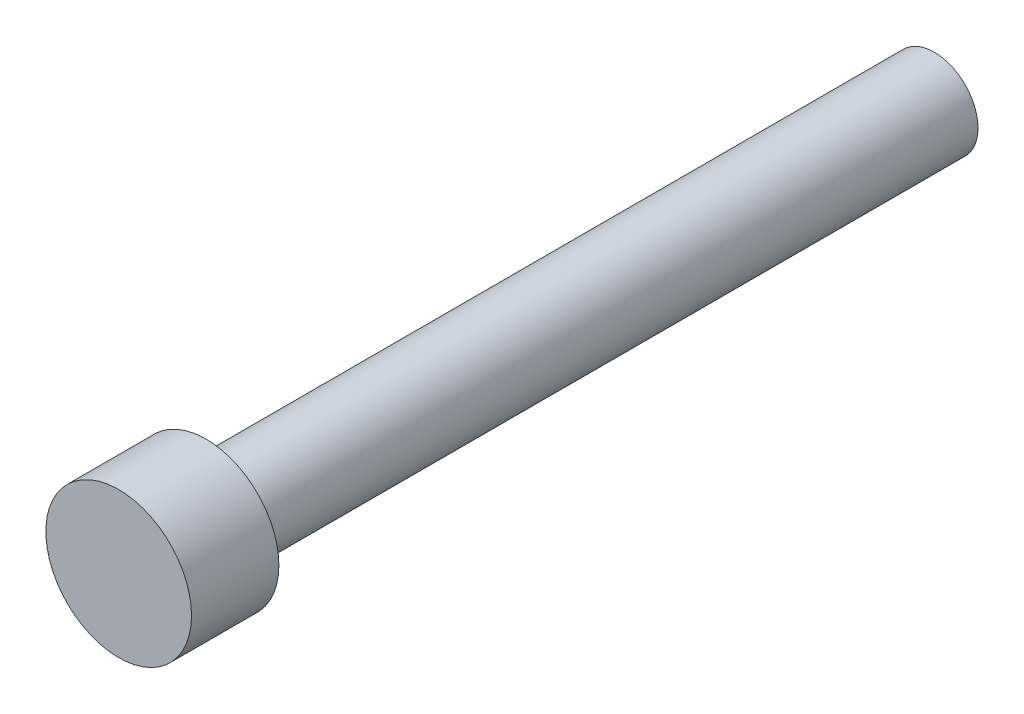
from build123d import *

# Parameters (mm, degrees)
SKETCH_1_R                      = 3
SHANK_SIMPLIFIED_DEPTH          = 50
SKETCH_2_R                      = 5
PURCHASED_HEAD_SIMPLIFIED_DEPTH = 6


with BuildPart() as part:
    # 草图1 → Shank_simplified (new body)
    with BuildSketch(Plane.XY):
        Circle(SKETCH_1_R)
    extrude(amount=SHANK_SIMPLIFIED_DEPTH)

    # 草图2 → Purchased_head_simplified (add)
    with BuildSketch(Plane.XY.offset(50)):
        Circle(SKETCH_2_R)
    extrude(amount=PURCHASED_HEAD_SIMPLIFIED_DEPTH)


solid = part.part
